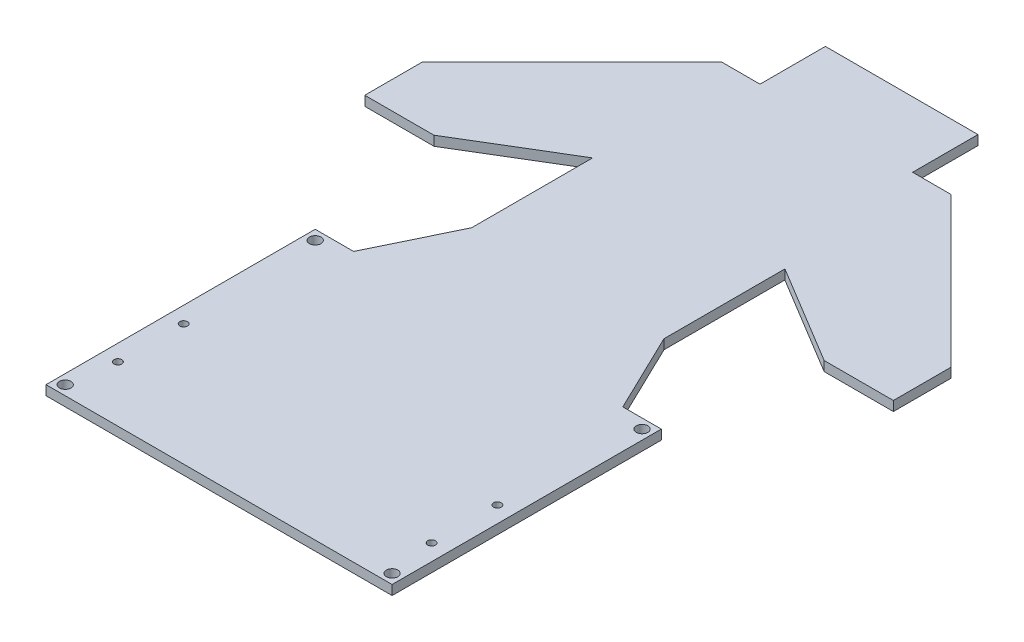
from build123d import *

# Parameters (mm, degrees)
SKETCH1_R           = 1.5
BOSS_EXTRUDE1_DEPTH = 2.5
SKETCH2_R           = 1
CUT_EXTRUDE1_DEPTH  = 10
SKETCH3_R           = 1
CUT_EXTRUDE2_DEPTH  = 10


with BuildPart() as part:
    # Sketch1 → Boss-Extrude1 (new body)
    with BuildSketch(Plane(origin=(0, 0, 0), x_dir=(1, 0, 0), z_dir=(0, 1, 0))):
        Polygon((-36.388124659, -49.061762216), (-46.388124659, -49.061762216), (-46.388124659, -119.061762216), (43.611875341, -119.061762216), (43.611875341, -49.061762216), (33.611875341, -49.061762216), (23.611875341, -28.368941333), (23.611875341, 3.086787883), (49.344702977, -12.442380613), (67.344702977, -12.442380613), (67.344702977, 2.557619387), (28.457213072, 41.451875118), (18.457213072, 41.451875118), (18.457213072, 58.451875118), (-21.230778371, 58.451875118), (-21.230778371, 41.451875118), (-31.230778371, 41.451875118), (-70.125034102, 2.564385214), (-70.125034102, -12.435614786), (-52.125034102, -12.435614786), (-26.388124659, 3.086787883), (-26.388124659, -28.368941333), align=None)
        with Locations(Location((41.111875341, -51.561762216, 0), (0, 0, 270))):
            Circle(SKETCH1_R, mode=Mode.SUBTRACT)
        with Locations(Location((-43.888124659, -51.561762216, 0), (0, 0, 270))):
            Circle(SKETCH1_R, mode=Mode.SUBTRACT)
        with Locations(Location((-43.888124659, -116.561762216, 0), (0, 0, 270))):
            Circle(SKETCH1_R, mode=Mode.SUBTRACT)
        with Locations(Location((41.111875341, -116.561762216, 0), (0, 0, 270))):
            Circle(SKETCH1_R, mode=Mode.SUBTRACT)
    extrude(amount=-BOSS_EXTRUDE1_DEPTH)

    # Sketch2 → Cut-Extrude1 (cut)
    with BuildSketch(Plane(origin=(0, 0, 0), x_dir=(1, 0, 0), z_dir=(0, 1, 0))):
        with Locations(Location((-42.188124659, -87.461762216, 0), (0, 0, 270))):
            Circle(SKETCH2_R)
        with Locations(Location((-42.188124659, -104.561762216, 0), (0, 0, 270))):
            Circle(SKETCH2_R)
    extrude(amount=-CUT_EXTRUDE1_DEPTH, mode=Mode.SUBTRACT)

    # Sketch3 → Cut-Extrude2 (cut)
    with BuildSketch(Plane(origin=(0, 0, 0), x_dir=(1, 0, 0), z_dir=(0, 1, 0))):
        with Locations(Location((39.381875341, -87.461762216, 0), (0, 0, 270))):
            Circle(SKETCH3_R)
        with Locations(Location((39.381875341, -104.561762216, 0), (0, 0, 270))):
            Circle(SKETCH3_R)
    extrude(amount=-CUT_EXTRUDE2_DEPTH, mode=Mode.SUBTRACT)


solid = part.part
